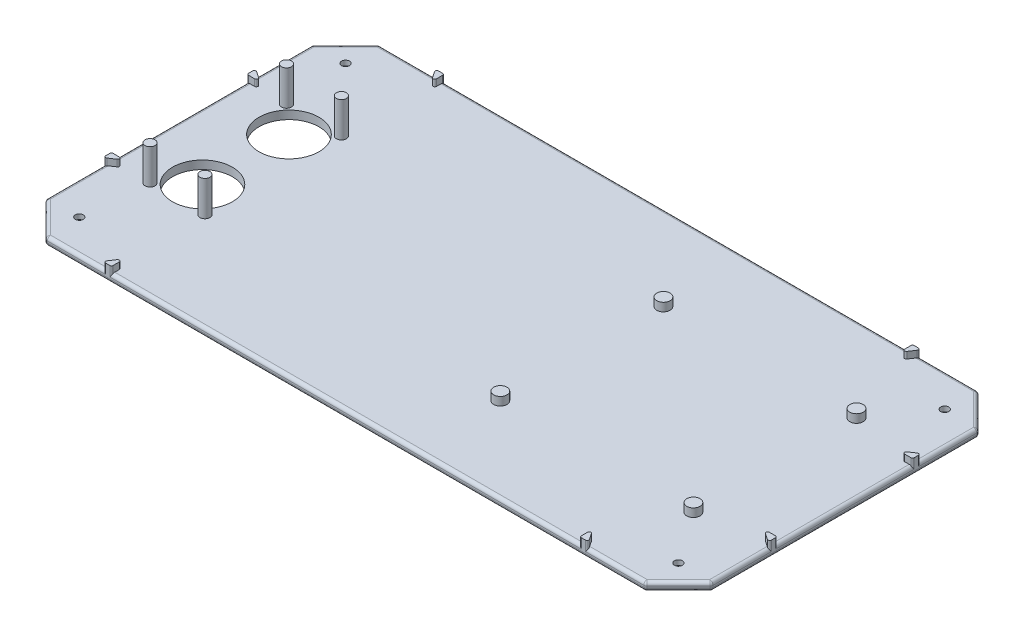
from build123d import *

# Parameters (mm, degrees)
BOSS_EXTRUDE1_DEPTH                             = 2.5
CSK_FOR_M2_FLAT_HEAD_MACHINE_SCREW1_D           = 2.4
CSK_FOR_M2_FLAT_HEAD_MACHINE_SCREW1_CSINK_D     = 4.4
CSK_FOR_M2_FLAT_HEAD_MACHINE_SCREW1_CSINK_ANGLE = 90
SKETCH6_R                                       = 1.5
BOSS_EXTRUDE2_DEPTH                             = 10.5
SKETCH7_R                                       = 9
CUT_EXTRUDE1_DEPTH                              = 10.5
SKETCH8_R                                       = 2
BOSS_EXTRUDE3_DEPTH                             = 2.5
BOSS_EXTRUDE4_DEPTH                             = 2
FILLET1_R                                       = 1
FILLET2_R                                       = 0.5


with BuildPart() as part:
    # Sketch1 → Boss-Extrude1 (new body)
    with BuildSketch(Plane(origin=(0, 0, 0), x_dir=(1, 0, 0), z_dir=(0, 1, 0))):
        Polygon((10, 0), (190, 0), (200, -10), (200, -90), (190, -100), (10, -100), (0, -90), (0, -10), align=None)
    extrude(amount=BOSS_EXTRUDE1_DEPTH)

    # CSK for M2 Flat Head Machine Screw1 (through all)
    with Locations(Plane(origin=(0, 0, 0), x_dir=(-1, 0, 0), z_dir=(0, -1, 0))):
        with Locations((-190, -10), (-190, -90), (-10, -10), (-10, -90)):
            CounterSinkHole(CSK_FOR_M2_FLAT_HEAD_MACHINE_SCREW1_D / 2, CSK_FOR_M2_FLAT_HEAD_MACHINE_SCREW1_CSINK_D / 2, counter_sink_angle=CSK_FOR_M2_FLAT_HEAD_MACHINE_SCREW1_CSINK_ANGLE)

    # Sketch6 → Boss-Extrude2 (add)
    with BuildSketch(Plane(origin=(0, 2.5, 0), x_dir=(1, 0, 0), z_dir=(0, 1, 0))):
        with Locations(Location((11.75, -29.5, 0), (0, 0, 90))):
            Circle(SKETCH6_R)
        with Locations(Location((11.75, -70.5, 0), (0, 0, 90))):
            Circle(SKETCH6_R)
        with Locations(Location((28.25, -70.5, 0), (0, 0, 90))):
            Circle(SKETCH6_R)
        with Locations(Location((28.25, -29.5, 0), (0, 0, 90))):
            Circle(SKETCH6_R)
    extrude(amount=BOSS_EXTRUDE2_DEPTH)

    # Sketch7 → Cut-Extrude1 (cut)
    with BuildSketch(Plane(origin=(0, 2.5, 0), x_dir=(1, 0, 0), z_dir=(0, 1, 0))):
        with Locations(Location((20, -37, 0), (0, 0, 270))):
            Circle(SKETCH7_R)
        with Locations(Location((20, -63, 0), (0, 0, 270))):
            Circle(SKETCH7_R)
    extrude(amount=-CUT_EXTRUDE1_DEPTH, mode=Mode.SUBTRACT)

    # Sketch8 → Boss-Extrude3 (add)
    with BuildSketch(Plane(origin=(0, 2.5, 0), x_dir=(1, 0, 0), z_dir=(0, 1, 0))):
        with Locations(Location((121, -25.5, 0), (0, 0, 90))):
            Circle(SKETCH8_R)
        with Locations(Location((121, -74.5, 0), (0, 0, 90))):
            Circle(SKETCH8_R)
        with Locations(Location((179, -74.5, 0), (0, 0, 90))):
            Circle(SKETCH8_R)
        with Locations(Location((179, -25.5, 0), (0, 0, 90))):
            Circle(SKETCH8_R)
    extrude(amount=BOSS_EXTRUDE3_DEPTH)

    # Sketch9 → Boss-Extrude4 (add)
    with BuildSketch(Plane(origin=(0, 2.5, 0), x_dir=(1, 0, 0), z_dir=(0, 1, 0))):
        Polygon((170.333333333, -96), (173, -100), (170.333333333, -100), align=None)
        Polygon((196, -70.333333333), (200, -73), (200, -70.333333333), align=None)
        Polygon((0, -70.333333333), (0, -73), (4, -70.333333333), align=None)
        Polygon((29.666666667, -100), (27, -100), (29.666666667, -96), align=None)
        Polygon((29.666666667, -4), (27, 0), (29.666666667, 0), align=None)
        Polygon((4, -29.666666667), (0, -27), (0, -29.666666667), align=None)
        Polygon((200, -29.666666667), (200, -27), (196, -29.666666667), align=None)
        Polygon((170.333333333, 0), (173, 0), (170.333333333, -4), align=None)
    extrude(amount=BOSS_EXTRUDE4_DEPTH)

    # Fillet1
    fillet1_edges = [part.edges().sort_by_distance(p)[0] for p in [
        (200, 2.5, 50),
        (100, 0, 0),
        (200, 2.5, 18.5),
        (100, 2.5, 0),
        (18.5, 2.5, 0),
        (0, 2.5, 50),
        (0, 2.5, 81.5),
        (100, 2.5, 100),
        (181.5, 2.5, 100),
        (195, 0, 5),
        (200, 0, 50),
        (195, 0, 95),
        (195, 2.5, 5),
        (190, 1.25, 100),
        (10, 1.25, 100),
        (0, 1.25, 90),
        (0, 1.25, 10),
        (10, 1.25, 0),
        (190, 1.25, 0),
        (200, 1.25, 10),
        (200, 1.25, 90),
        (181.5, 2.5, 0),
        (5, 2.5, 5),
        (0, 2.5, 18.5),
        (5, 2.5, 95),
        (18.5, 2.5, 100),
        (195, 2.5, 95),
        (100, 0, 100),
        (200, 2.5, 81.5),
        (5, 0, 95),
        (0, 0, 50),
        (5, 0, 5),
    ]]
    fillet(fillet1_edges, radius=FILLET1_R)

    # Fillet2
    fillet2_edges = [part.edges().sort_by_distance(p)[0] for p in [
        (29.666666667, 3.5, 96),
        (29.666666667, 3, 100),
        (27, 3, 100),
        (4, 3.5, 70.333333333),
        (0, 3, 73),
        (0, 3, 70.333333333),
        (4, 3.5, 29.666666667),
        (0, 3, 29.666666667),
        (0, 3, 27),
        (29.666666667, 3, 0),
        (27, 3, 0),
        (29.666666667, 3.5, 4),
        (173, 3, 0),
        (170.333333333, 3, 0),
        (170.333333333, 3.5, 4),
        (196, 3.5, 29.666666667),
        (200, 3, 27),
        (200, 3, 29.666666667),
        (196, 3.5, 70.333333333),
        (200, 3, 70.333333333),
        (200, 3, 73),
        (170.333333333, 3.5, 96),
        (170.333333333, 3, 100),
        (173, 3, 100),
    ]]
    fillet(fillet2_edges, radius=FILLET2_R)


solid = part.part
